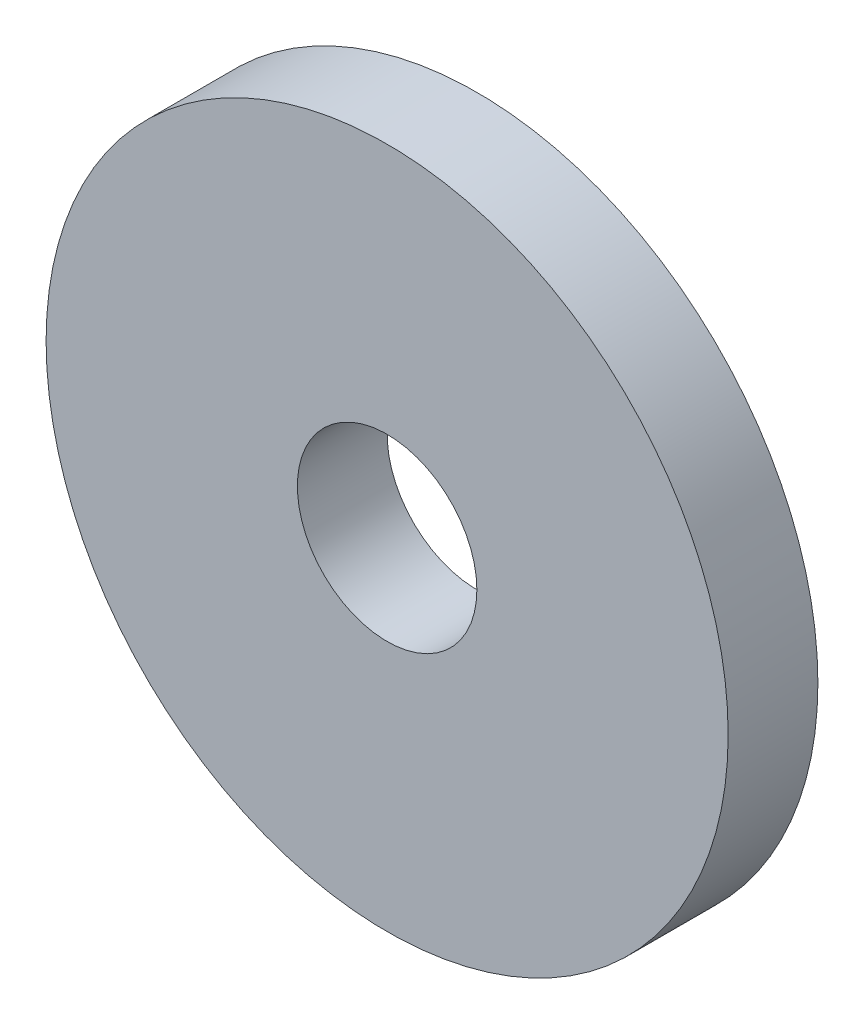
from build123d import *

# Parameters (mm, degrees)
SKETCH1_R           = 9.5
SKETCH1_R_2         = 2.5
BOSS_EXTRUDE1_DEPTH = 2.5


with BuildPart() as part:
    # Sketch1 → Boss-Extrude1 (new body)
    with BuildSketch(Plane.XY):
        Circle(SKETCH1_R)
        Circle(SKETCH1_R_2, mode=Mode.SUBTRACT)
    extrude(amount=BOSS_EXTRUDE1_DEPTH)


solid = part.part
